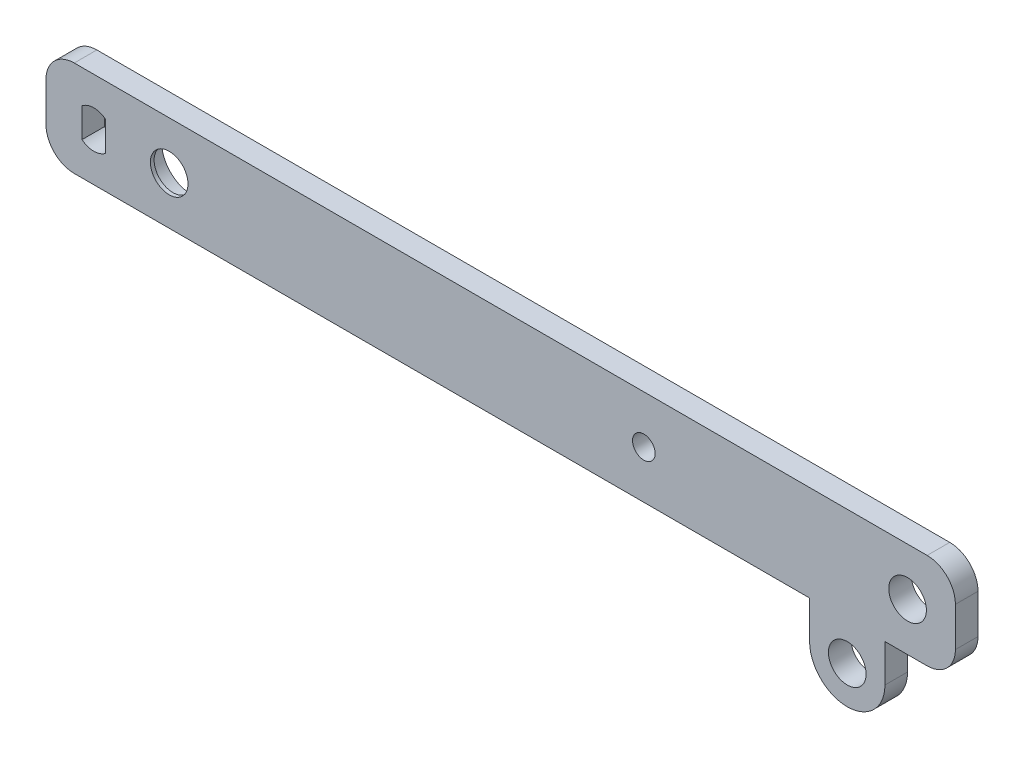
from build123d import *

# Parameters (mm, degrees)
CROQUIS1_R              = 10
CROQUIS1_R_2            = 6
SALIENTE_EXTRUIR1_DEPTH = 12
CROQUIS2_R              = 2.144956207
CORTAR_EXTRUIR1_DEPTH   = 3
CROQUIS3_R              = 16
CORTAR_EXTRUIR2_DEPTH   = 10
REDONDEO1_R             = 15
REDONDEO2_R             = 15


with BuildPart() as part:
    # Croquis1 → Saliente-Extruir1 (new body)
    with BuildSketch(Plane.XY):
        with BuildLine():
            Line((380, -45.4), (380, -25.4))
            Line((380, -25.4), (-25.4, -25.4))
            Line((-25.4, -25.4), (-25.4, 25.4))
            Line((-25.4, 25.4), (457.4, 25.4))
            Line((457.4, 25.4), (457.4, -25.4))
            Line((457.4, -25.4), (420, -25.4))
            Line((420, -25.4), (420, -45.4))
            ThreePointArc((420, -45.4), (400, -65.4), (380, -45.4))
        make_face()
        with Locations((432, 0)):
            Circle(CROQUIS1_R, mode=Mode.SUBTRACT)
        with Locations((40, 0)):
            Circle(CROQUIS1_R, mode=Mode.SUBTRACT)
        with Locations((292, 0)):
            Circle(CROQUIS1_R_2, mode=Mode.SUBTRACT)
        with Locations((400, -45.4)):
            Circle(CROQUIS1_R, mode=Mode.SUBTRACT)
        with BuildLine():
            Line((-6.28, -7.782133384), (-6.28, 7.782133384))
            ThreePointArc((-6.28, 7.782133384), (0, 10), (6.28, 7.782133384))
            Line((6.28, 7.782133384), (6.28, -7.782133384))
            ThreePointArc((6.28, -7.782133384), (0, -10), (-6.28, -7.782133384))
        make_face(mode=Mode.SUBTRACT)
    extrude(amount=SALIENTE_EXTRUIR1_DEPTH)

    # Croquis2 → Cortar-Extruir1 (cut)
    with BuildSketch(Plane(origin=(0, 0, 0), x_dir=(-1, 0, 0), z_dir=(0, 0, -1))):
        with Locations((-66.437001332, -11.298220954)):
            Circle(CROQUIS2_R)
    extrude(amount=-CORTAR_EXTRUIR1_DEPTH, mode=Mode.SUBTRACT)

    # Croquis3 → Cortar-Extruir2 (cut)
    with BuildSketch(Plane(origin=(0, 0, 0), x_dir=(-1, 0, 0), z_dir=(0, 0, -1))):
        with Locations((-40, 0)):
            Circle(CROQUIS3_R)
    extrude(amount=-CORTAR_EXTRUIR2_DEPTH, mode=Mode.SUBTRACT)

    # Redondeo1
    redondeo1_edges = [part.edges().sort_by_distance(p)[0] for p in [
        (-25.4, 25.4, 6),
        (-25.4, -25.4, 6),
    ]]
    fillet(redondeo1_edges, radius=REDONDEO1_R)

    # Redondeo2
    redondeo2_edges = [part.edges().sort_by_distance(p)[0] for p in [
        (457.4, 25.4, 6),
        (457.4, -25.4, 6),
    ]]
    fillet(redondeo2_edges, radius=REDONDEO2_R)


solid = part.part
